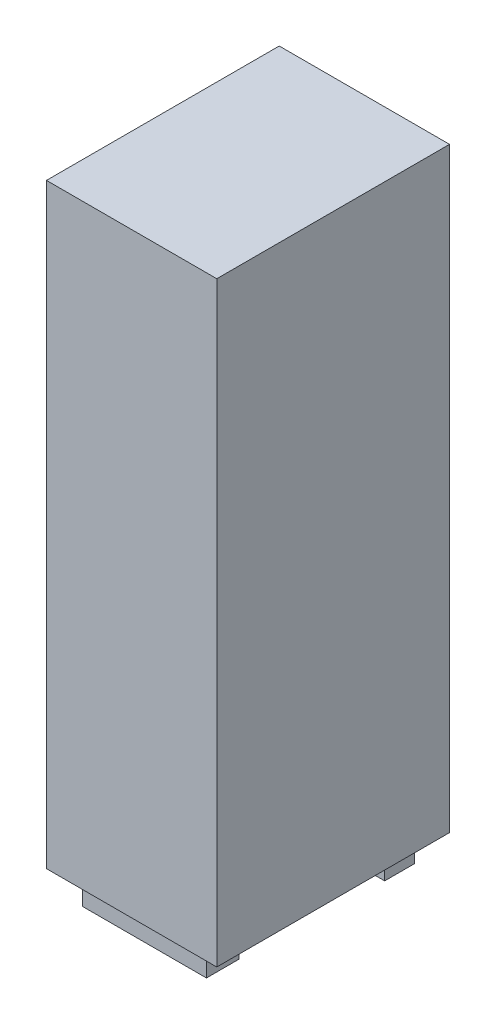
from build123d import *

# Parameters (mm, degrees)
SKETCH1_W           = 30
SKETCH1_H           = 41
BOSS_EXTRUDE1_DEPTH = 105
SKETCH2_W           = 21.801991159
SKETCH2_H           = 5.700874013
SKETCH2_W_2         = 22.379782444
SKETCH2_H_2         = 5.277160404
BOSS_EXTRUDE2_DEPTH = 5


with BuildPart() as part:
    # Sketch1 → Boss-Extrude1 (new body)
    with BuildSketch(Plane(origin=(0, 0, 0), x_dir=(1, 0, 0), z_dir=(0, 1, 0))):
        Rectangle(SKETCH1_W, SKETCH1_H)
    extrude(amount=BOSS_EXTRUDE1_DEPTH)

    # Sketch2 → Boss-Extrude2 (add)
    with BuildSketch(Plane.XZ):
        with Locations((-0.134817966, 15.234430217)):
            Rectangle(SKETCH2_W, SKETCH2_H)
        with Locations((0.462233028, -15.061092832)):
            Rectangle(SKETCH2_W_2, SKETCH2_H_2)
    extrude(amount=BOSS_EXTRUDE2_DEPTH)


solid = part.part
